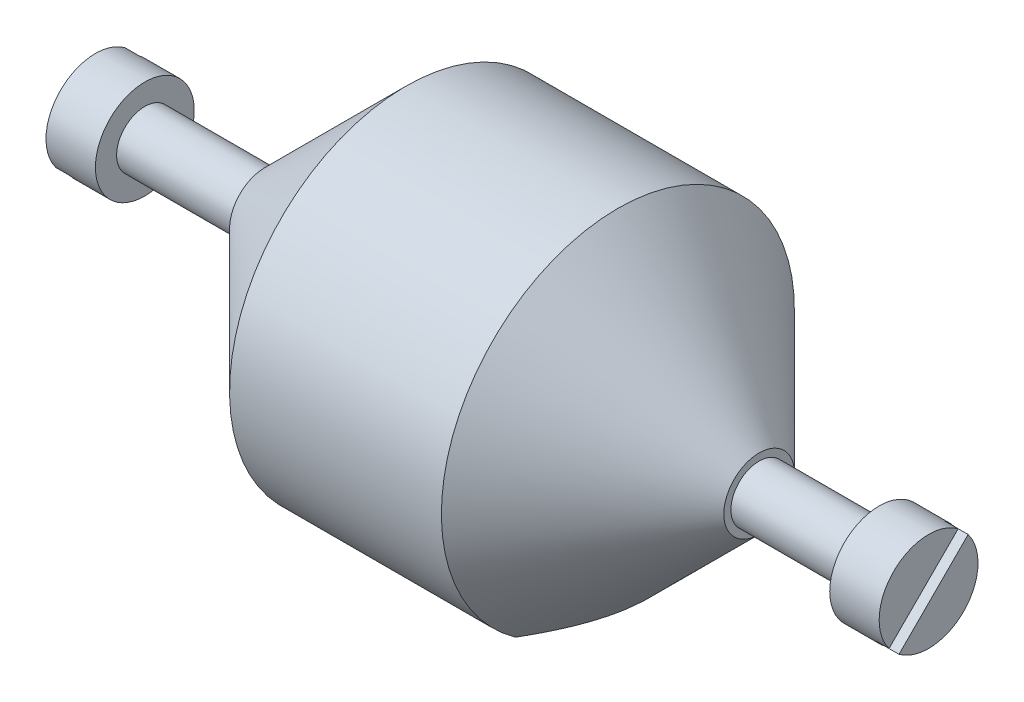
from build123d import *

# Parameters (mm, degrees)
SKETCH1_R           = 12.5
BOSS_EXTRUDE1_DEPTH = 17.5
SKETCH2_R           = 2
BOSS_EXTRUDE2_DEPTH = 26
CHAMFER1_SIZE       = 10
SKETCH3_W           = 28.997372317
SKETCH3_H           = 7.197339184
CUT_EXTRUDE1_DEPTH  = 20
SKETCH4_R           = 5
CUT_EXTRUDE2_DEPTH  = 5
SKETCH5_R           = 3.5
BOSS_EXTRUDE3_DEPTH = 3.5
CUT_EXTRUDE6_START  = -1
CUT_EXTRUDE6_DEPTH  = 1
SKETCH11_R          = 5
SKETCH11_R_2        = 1.25
BOSS_EXTRUDE4_DEPTH = 5
SKETCH12_R          = 2.5
CUT_EXTRUDE7_DEPTH  = 5


with BuildPart() as part:
    # Sketch1 → Boss-Extrude1 (new, symmetric)
    with BuildSketch(Plane(origin=(0, 0, 0), x_dir=(0, 0, -1), z_dir=(1, 0, 0))):
        Circle(SKETCH1_R)
    extrude(amount=BOSS_EXTRUDE1_DEPTH, both=True)

    # Sketch2 → Boss-Extrude2 (add, symmetric)
    with BuildSketch(Plane(origin=(0, 0, 0), x_dir=(0, 0, -1), z_dir=(1, 0, 0))):
        with Locations(Location((0, 0, 0), (0, 0, 180))):
            Circle(SKETCH2_R)
    extrude(amount=BOSS_EXTRUDE2_DEPTH, both=True)

    # Chamfer1
    chamfer1_edges = [part.edges().sort_by_distance(p)[0] for p in [
        (-17.5, 0, 12.5),
        (17.5, 0, 12.5),
    ]]
    chamfer(chamfer1_edges, length=CHAMFER1_SIZE)

    # Sketch3 → Cut-Extrude1 (cut, symmetric)
    with BuildSketch(Plane(origin=(0, 0, 0), x_dir=(0, 0, -1), z_dir=(1, 0, 0))):
        with Locations((0.644848308, -13.770631617)):
            Rectangle(SKETCH3_W, SKETCH3_H)
    extrude(amount=CUT_EXTRUDE1_DEPTH, both=True, mode=Mode.SUBTRACT)

    # Sketch4 → Cut-Extrude2 (cut)
    with BuildSketch(Plane.XZ.offset(10.171962025)):
        with Locations(Location((0, 0, 0), (0, 0, 270))):
            Circle(SKETCH4_R)
    extrude(amount=-CUT_EXTRUDE2_DEPTH, mode=Mode.SUBTRACT)

    # Sketch5 → Boss-Extrude3 (add)
    with BuildSketch(Plane.ZY.offset(26)):
        Circle(SKETCH5_R)
    boss_extrude3 = extrude(amount=BOSS_EXTRUDE3_DEPTH)

    # Sketch6 → Cut-Extrude6 (cut)
    with BuildSketch(Plane.ZY.offset(29.5).offset(CUT_EXTRUDE6_START)):
        with BuildLine():
            Line((2.803043133, -2.095936352), (-2.095936352, 2.803043133))
            ThreePointArc((-2.095936352, 2.803043133), (-2.474873734, 2.474873734), (-2.803043133, 2.095936352))
            Line((-2.803043133, 2.095936352), (2.095936352, -2.803043133))
            ThreePointArc((2.095936352, -2.803043133), (2.474873734, -2.474873734), (2.803043133, -2.095936352))
        make_face()
    cut_extrude6 = extrude(amount=CUT_EXTRUDE6_DEPTH, mode=Mode.SUBTRACT)

    # Mirror1: Boss-Extrude3, Cut-Extrude6 across plane
    add(boss_extrude3.mirror(Plane(origin=(0, 0, 0), x_dir=(0, 0, 1), z_dir=(1, 0, 0))))
    add(cut_extrude6.mirror(Plane(origin=(0, 0, 0), x_dir=(0, 0, 1), z_dir=(1, 0, 0))), mode=Mode.SUBTRACT)

    # Sketch11 → Boss-Extrude4 (add)
    with BuildSketch(Plane.XZ.offset(10.171962025)):
        Circle(SKETCH11_R)
        with Locations(Location((0, 0, 0), (0, 0, 270))):
            Circle(SKETCH11_R_2, mode=Mode.SUBTRACT)
    extrude(amount=-BOSS_EXTRUDE4_DEPTH)

    # Sketch12 → Cut-Extrude7 (cut)
    with BuildSketch(Plane.XZ.offset(10.171962025)):
        with Locations(Location((0, 0, 0), (0, 0, 270))):
            Circle(SKETCH12_R)
    extrude(amount=-CUT_EXTRUDE7_DEPTH, mode=Mode.SUBTRACT)


solid = part.part
